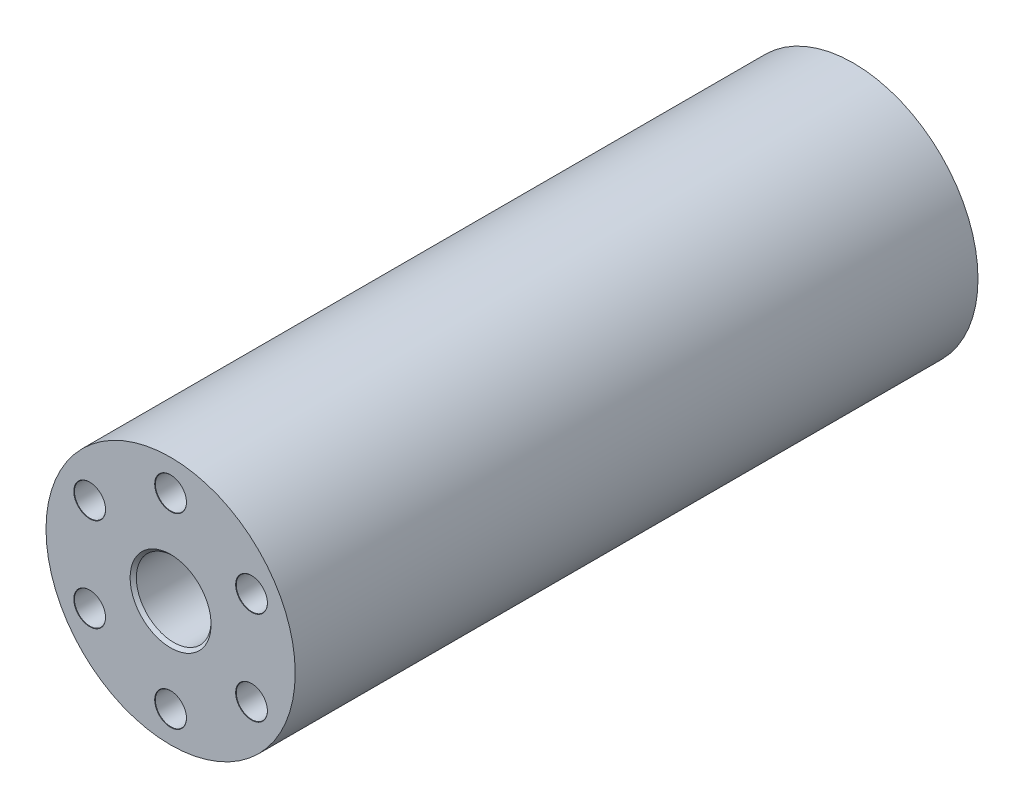
from build123d import *

# Parameters (mm, degrees)
SKETCH1_R                         = 10
BOSS_EXTRUDE1_DEPTH               = 54.8
TAP_DRILL_FOR_M3_TAP1_D           = 2.5
TAP_DRILL_FOR_M3_TAP1_DEPTH       = 6
TAP_DRILL_FOR_M3_TAP1_CSINK_D     = 2.55
TAP_DRILL_FOR_M3_TAP1_CSINK_ANGLE = 90
TAP_DRILL_FOR_M3_TAP1_TIP         = 0.751075774
TAP_DRILL_FOR_M3_TAP2_D           = 2.5
TAP_DRILL_FOR_M3_TAP2_DEPTH       = 6
TAP_DRILL_FOR_M3_TAP2_CSINK_D     = 2.55
TAP_DRILL_FOR_M3_TAP2_CSINK_ANGLE = 90
TAP_DRILL_FOR_M3_TAP2_TIP         = 0.751075774


with BuildPart() as part:
    # Sketch1 → Boss-Extrude1 (new body)
    with BuildSketch(Plane.XY):
        with Locations(Location((0, 0, 0), (0, 0, 180))):
            Circle(SKETCH1_R)
    extrude(amount=BOSS_EXTRUDE1_DEPTH)

    # Sketch4 → Ø6.0mm Dowel Hole1 (revolve, cut)
    with BuildSketch(Plane.YZ):
        Polygon((0, 0), (0, 54.8), (3.25, 54.8), (3, 54.55), (3, 0.25), (3.25, 0), align=None)
    revolve(axis=Axis((0, 0, -6.35), (0, 0, 1)), mode=Mode.SUBTRACT)

    # Tap Drill for M3 Tap1
    with Locations(Plane(origin=(0, 0, 0), x_dir=(-1, 0, 0), z_dir=(0, 0, -1))):
        with Locations((-6.062177826, -3.5), (0, 7), (6.062177826, -3.5)):
            CounterSinkHole(TAP_DRILL_FOR_M3_TAP1_D / 2, TAP_DRILL_FOR_M3_TAP1_CSINK_D / 2, depth=TAP_DRILL_FOR_M3_TAP1_DEPTH, counter_sink_angle=TAP_DRILL_FOR_M3_TAP1_CSINK_ANGLE)
            with Locations((0, 0, -(TAP_DRILL_FOR_M3_TAP1_DEPTH + TAP_DRILL_FOR_M3_TAP1_TIP / 2))):  # 118° drill point
                Cone(0, TAP_DRILL_FOR_M3_TAP1_D / 2, TAP_DRILL_FOR_M3_TAP1_TIP, mode=Mode.SUBTRACT)

    # Tap Drill for M3 Tap2
    with Locations(Plane.XY.offset(54.8)):
        with Locations((-6.495190528, 3.75), (0, 7.5), (6.495190528, 3.75), (6.495190528, -3.75), (0, -7.5), (-6.495190528, -3.75)):
            CounterSinkHole(TAP_DRILL_FOR_M3_TAP2_D / 2, TAP_DRILL_FOR_M3_TAP2_CSINK_D / 2, depth=TAP_DRILL_FOR_M3_TAP2_DEPTH, counter_sink_angle=TAP_DRILL_FOR_M3_TAP2_CSINK_ANGLE)
            with Locations((0, 0, -(TAP_DRILL_FOR_M3_TAP2_DEPTH + TAP_DRILL_FOR_M3_TAP2_TIP / 2))):  # 118° drill point
                Cone(0, TAP_DRILL_FOR_M3_TAP2_D / 2, TAP_DRILL_FOR_M3_TAP2_TIP, mode=Mode.SUBTRACT)


solid = part.part
